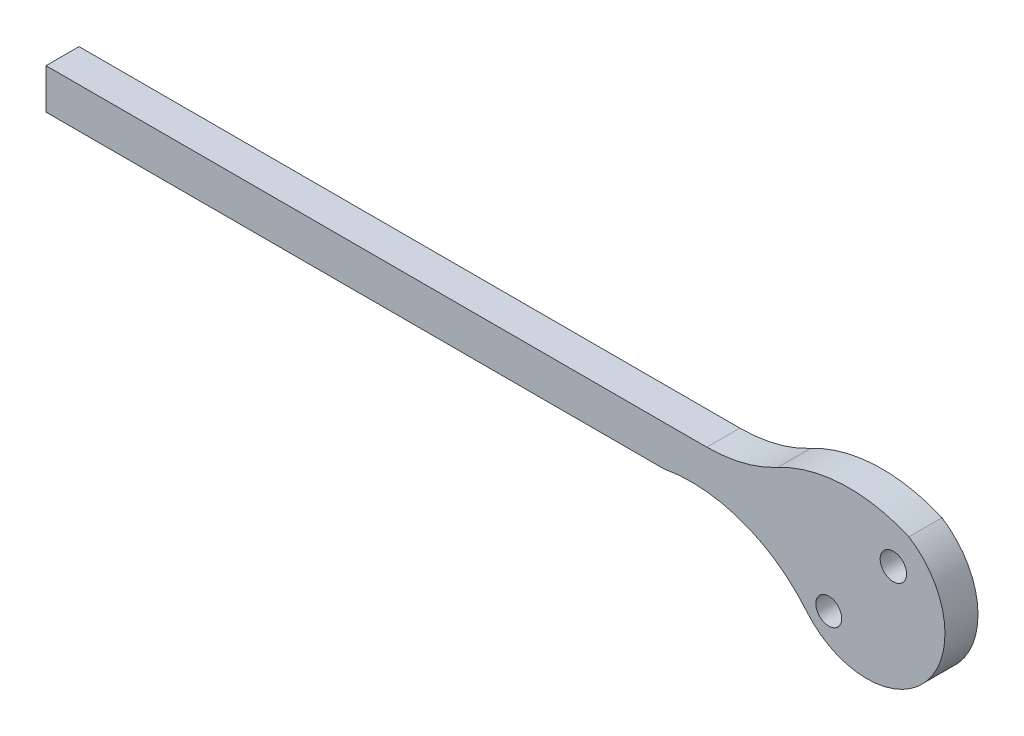
from build123d import *

# Parameters (mm, degrees)
SKETCH2_R           = 2.54
SKETCH2_R_2         = 2.4892
BOSS_EXTRUDE4_DEPTH = 6.35


with BuildPart() as part:
    # Sketch2 → Boss-Extrude4 (new body)
    with BuildSketch(Plane.XY):
        with BuildLine():
            Line((16.553800999, 15.563538937), (-110.446199, 15.563538937))
            Line((-110.446199, 15.563538937), (-110.446199, 7.829313497))
            Line((-110.446199, 7.829313497), (8.327469614, 7.829313497))
            ThreePointArc((8.327469614, 7.829313497), (23.37971128, 6.58692566), (35.712064399, -2.132396173))
            ThreePointArc((35.712064399, -2.132396173), (58.549875935, -2.549801063), (55.400729061, 20.07369859))
            ThreePointArc((55.400729061, 20.07369859), (42.655168222, 22.428960004), (30.15762825, 18.992672461))
            ThreePointArc((30.15762825, 18.992672461), (23.568483326, 16.434024055), (16.553800999, 15.563538937))
        make_face()
        with Locations((52.410677776, 13.634120609)):
            Circle(SKETCH2_R, mode=Mode.SUBTRACT)
        with Locations((40, 2e-09)):
            Circle(SKETCH2_R_2, mode=Mode.SUBTRACT)
    extrude(amount=BOSS_EXTRUDE4_DEPTH)


solid = part.part
